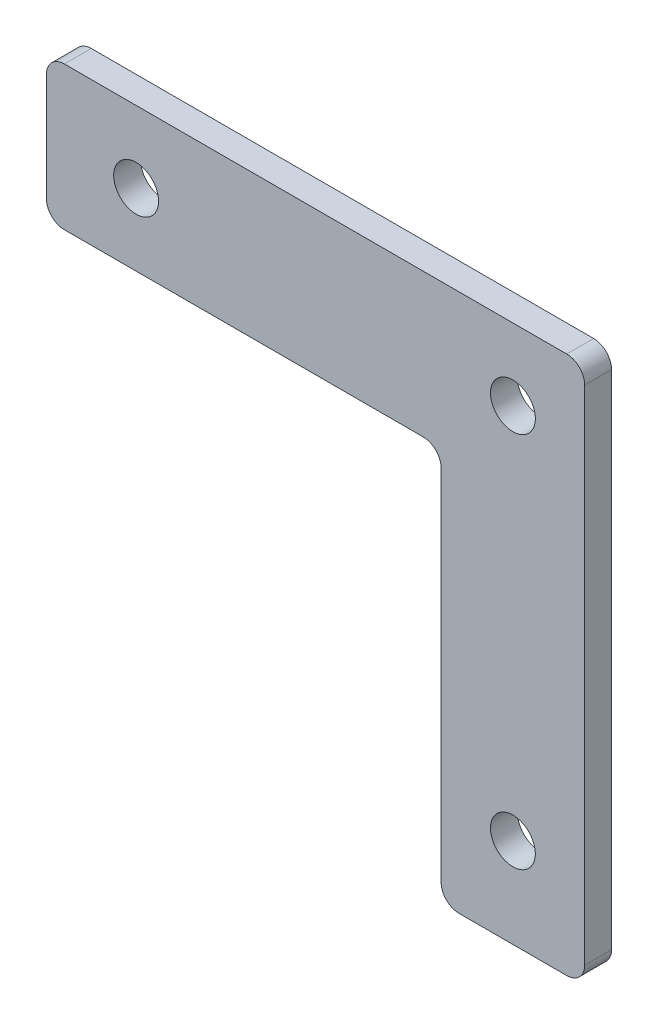
from build123d import *

# Parameters (mm, degrees)
BOSS_EXTRUDE1_DEPTH   = 3
SKETCH2_R             = 2.5
CUT_EXTRUDE1_DEPTH    = 3
FILLET1_R             = 2
F_5_0MM_DOWEL_HOLE1_D = 5


with BuildPart() as part:
    # Sketch1 → Boss-Extrude1 (new body)
    with BuildSketch(Plane.XY):
        Polygon((0, 0), (44, 0), (44, -44), (60, -44), (60, -15.656804173), (60, 16), (0, 16), align=None)
    extrude(amount=BOSS_EXTRUDE1_DEPTH)

    # Sketch2 → Cut-Extrude1 (cut)
    with BuildSketch(Plane.XY.offset(3)):
        with Locations((10, 8)):
            Circle(SKETCH2_R)
        with Locations((52, -34)):
            Circle(SKETCH2_R)
    extrude(amount=-CUT_EXTRUDE1_DEPTH, mode=Mode.SUBTRACT)

    # Fillet1
    fillet1_edges = [part.edges().sort_by_distance(p)[0] for p in [
        (0, 16, 1.5),
        (60, 16, 1.5),
        (60, -44, 1.5),
        (44, -44, 1.5),
        (44, 0, 1.5),
        (0, 0, 1.5),
    ]]
    fillet(fillet1_edges, radius=FILLET1_R)

    # Ø5.0mm Dowel Hole1 (through all)
    with Locations(Plane(origin=(0, 0, 0), x_dir=(-1, 0, 0), z_dir=(0, 0, -1))):
        with Locations((-52, 8)):
            Hole(F_5_0MM_DOWEL_HOLE1_D / 2)


solid = part.part
